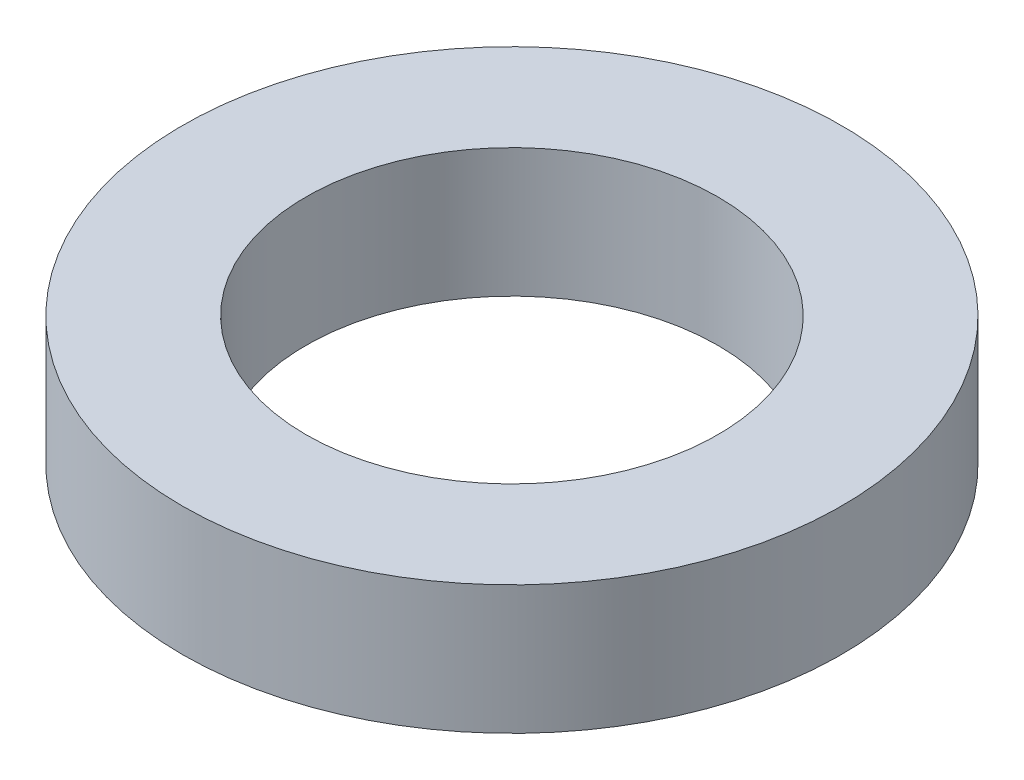
from build123d import *

# Parameters (mm, degrees)
SKETCH1_R           = 12.7
SKETCH1_R_2         = 7.9375
BOSS_EXTRUDE1_DEPTH = 4.95665


with BuildPart() as part:
    # Sketch1 → Boss-Extrude1 (new body)
    with BuildSketch(Plane(origin=(0, 0, 0), x_dir=(1, 0, 0), z_dir=(0, 1, 0))):
        with Locations(Location((0, 0, 0), (0, 0, 270))):
            Circle(SKETCH1_R)
        with Locations(Location((0, 0, 0), (0, 0, 270))):
            Circle(SKETCH1_R_2, mode=Mode.SUBTRACT)
    extrude(amount=BOSS_EXTRUDE1_DEPTH)


solid = part.part
